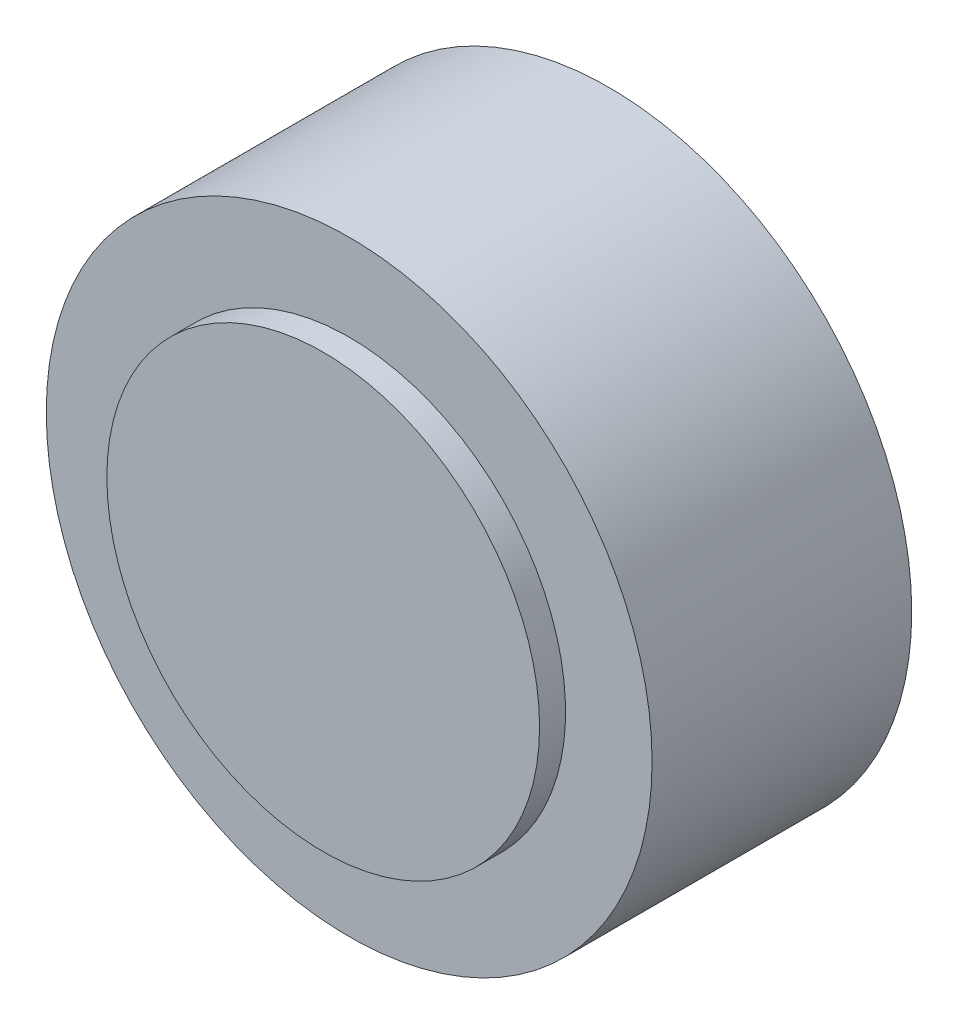
from build123d import *

# Parameters (mm, degrees)
ESQUISSE1_R             = 25
BOSS_EXTRU_1_DEPTH      = 35
BOSS_EXTRU_2_START      = -2
ESQUISSE3_R             = 35
ESQUISSE3_R_2           = 25
BOSS_EXTRU_2_DEPTH      = 30
ESQUISSE4_R             = 7
ESQUISSE4_R_2           = 2
BOSS_EXTRU_3_DEPTH      = 5
ESQUISSE5_R             = 1.5
ENL_V_MAT_EXTRU_1_DEPTH = 61.621778265


with BuildPart() as part:
    # Esquisse1 → Boss.-Extru.1 (new body)
    with BuildSketch(Plane.XY):
        Circle(ESQUISSE1_R)
    extrude(amount=BOSS_EXTRU_1_DEPTH)

    # Esquisse3 → Boss.-Extru.2 (add)
    with BuildSketch(Plane(origin=(0, 0, 0), x_dir=(-1, 0, 0), z_dir=(0, 0, -1)).offset(BOSS_EXTRU_2_START)):
        Circle(ESQUISSE3_R)
        Circle(ESQUISSE3_R_2, mode=Mode.SUBTRACT)
    extrude(amount=-BOSS_EXTRU_2_DEPTH)

    # Esquisse4 → Boss.-Extru.3 (add)
    with BuildSketch(Plane(origin=(0, 0, 0), x_dir=(-1, 0, 0), z_dir=(0, 0, -1))):
        Circle(ESQUISSE4_R)
        Circle(ESQUISSE4_R_2, mode=Mode.SUBTRACT)
    extrude(amount=BOSS_EXTRU_3_DEPTH)

    # Esquisse5 → Enlèv. mat.-Extru.1 (cut, through all)
    with BuildSketch(Plane(origin=(0, 0, 0), x_dir=(1, 0, 0), z_dir=(0, 1, 0))):
        with Locations(Location((0, 2.5, 0), (0, 0, 90))):
            Circle(ESQUISSE5_R)
    extrude(amount=ENL_V_MAT_EXTRU_1_DEPTH, mode=Mode.SUBTRACT)


solid = part.part
